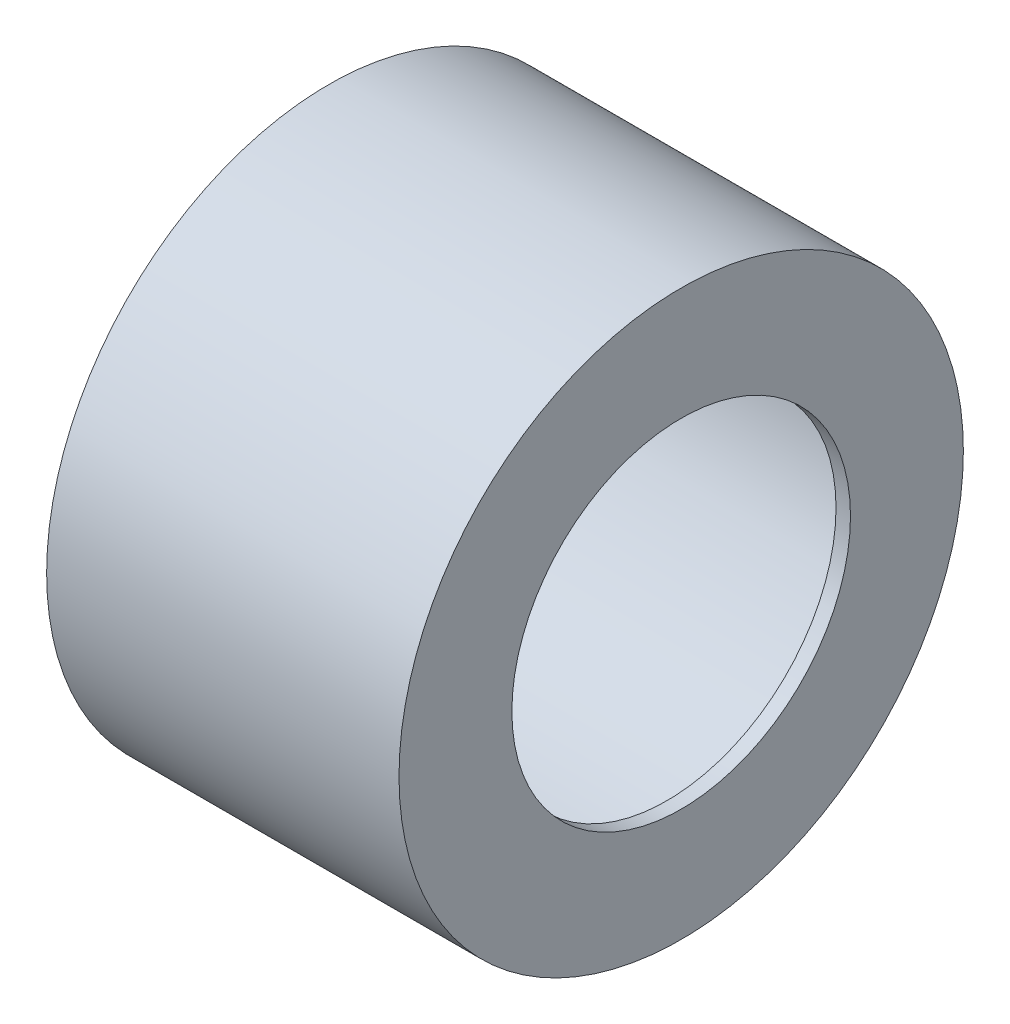
from build123d import *


with BuildPart() as part:
    # Axial profile (mm) → Full revolution (revolve)
    with BuildSketch(Plane.XY, mode=Mode.PRIVATE) as full_revolution_sk:
        Polygon((135.7, 36.4), (182.4, 36.4), (182.4, 23.4), (184.4, 23.4), (184.4, 39), (135.7, 39), align=None)
    revolve(full_revolution_sk.sketch.rotate(Axis((-110, 0, 0), (1, 0, 0)), 90), axis=Axis((-110, 0, 0), (1, 0, 0)))


solid = part.part
